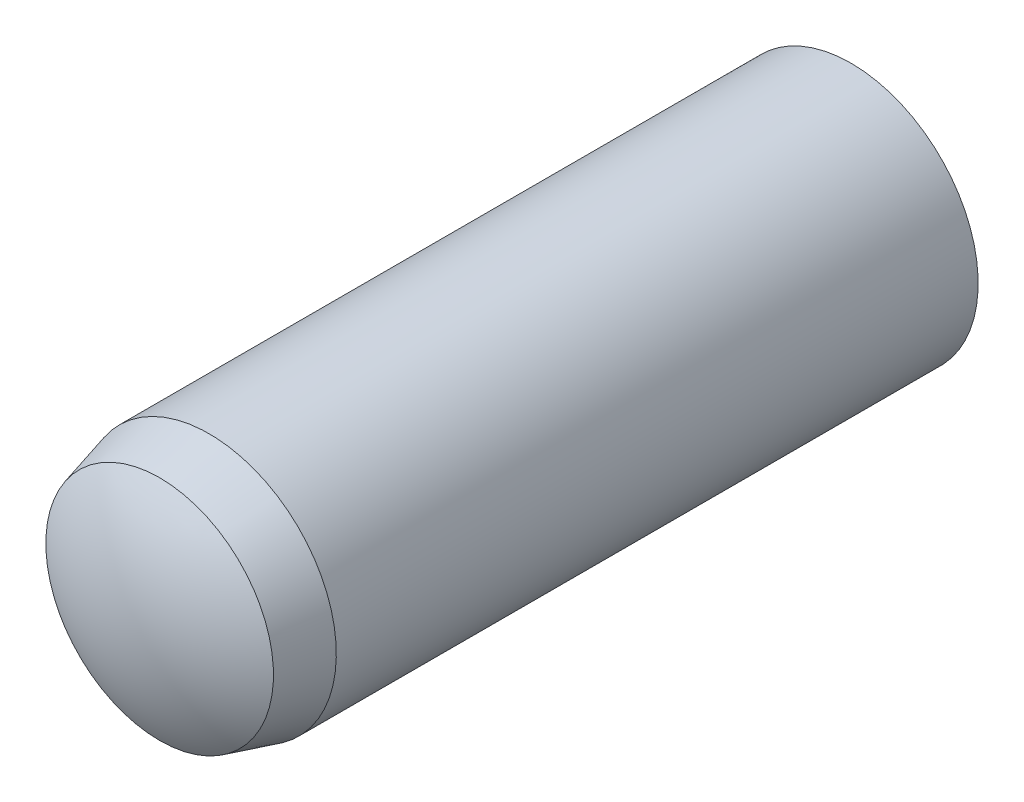
from build123d import *


with BuildPart() as part:
    # Sketch3 → Revolve1 (revolve)
    with BuildSketch(Plane(origin=(0, 0, 0), x_dir=(0, 0, -1), z_dir=(1, 0, 0))):
        with BuildLine():
            Line((-3, 0), (3, 0))
            ThreePointArc((3, 0), (2.923384418, 0.522015325), (2.7, 1))
            Line((2.7, 1), (-2.35, 1))
            Line((-2.35, 1), (-2.74, 0.895499815))
            ThreePointArc((-2.74, 0.895499815), (-2.933685026, 0.46624026), (-3, 0))
        make_face()
    revolve(axis=Axis((0, 0, 3), (0, 0, -1)))


solid = part.part
